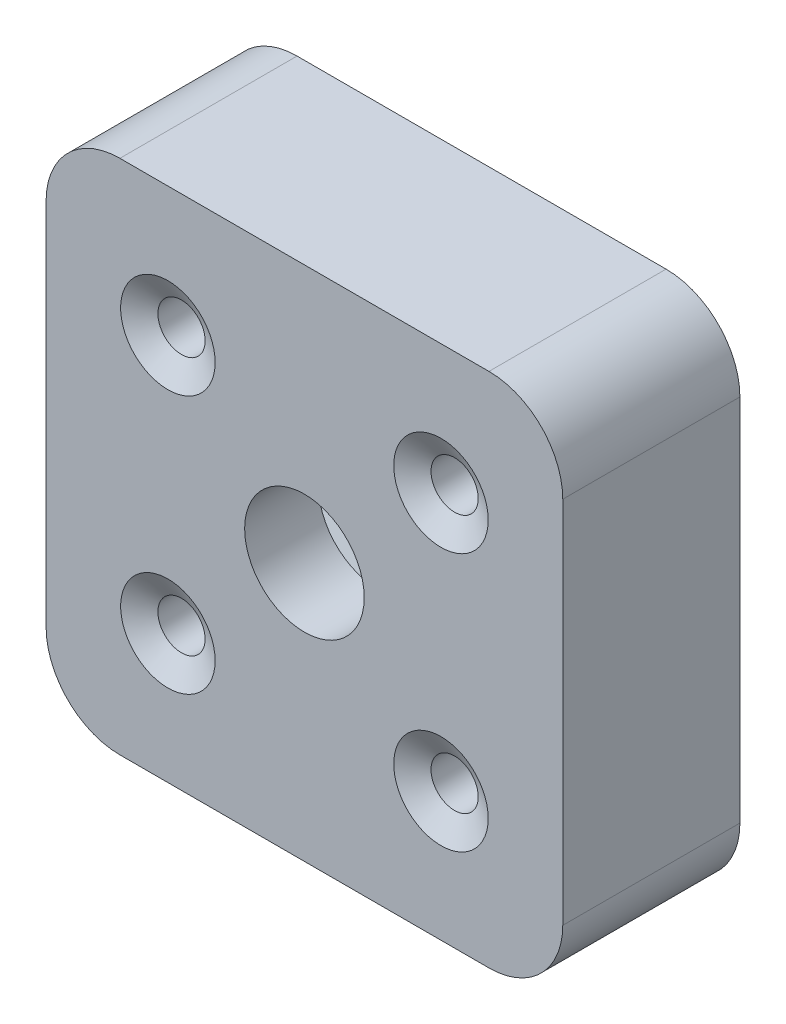
from build123d import *

# Parameters (mm, degrees)
SKETCH1_W                    = 35
SKETCH1_H                    = 35
SKETCH1_R                    = 4.05
SKETCH1_R_2                  = 1.6
BOSS_EXTRUDE1_DEPTH          = 12
FILLET1_R                    = 5
SKETCH5_R                    = 3.2
CUT_EXTRUDE1_DEPTH           = 1
CUT_EXTRUDE1_DRAFT           = -60
CUT_EXTRUDE1_PROFILE_2_DEPTH = 1
CUT_EXTRUDE1_PROFILE_2_DRAFT = -60
CUT_EXTRUDE1_PROFILE_3_DEPTH = 1
CUT_EXTRUDE1_PROFILE_3_DRAFT = -60
CUT_EXTRUDE1_PROFILE_4_DEPTH = 1
CUT_EXTRUDE1_PROFILE_4_DRAFT = -60
CUT_EXTRUDE2_DEPTH           = 7


with BuildPart() as part:
    # Sketch1 → Boss-Extrude1 (new body)
    with BuildSketch(Plane.XY):
        Rectangle(SKETCH1_W, SKETCH1_H)
        Circle(SKETCH1_R, mode=Mode.SUBTRACT)
        with Locations((-9.25, 8.75)):
            Circle(SKETCH1_R_2, mode=Mode.SUBTRACT)
        with Locations((9.25, 8.75)):
            Circle(SKETCH1_R_2, mode=Mode.SUBTRACT)
        with Locations((-9.25, -8.75)):
            Circle(SKETCH1_R_2, mode=Mode.SUBTRACT)
        with Locations((9.25, -8.75)):
            Circle(SKETCH1_R_2, mode=Mode.SUBTRACT)
    extrude(amount=BOSS_EXTRUDE1_DEPTH)

    # Fillet1
    fillet1_edges = [part.edges().sort_by_distance(p)[0] for p in [
        (-17.5, -17.5, 6),
        (-17.5, 17.5, 6),
        (17.5, 17.5, 6),
        (17.5, -17.5, 6),
    ]]
    fillet(fillet1_edges, radius=FILLET1_R)


with BuildPart() as cut_extrude1_tool:
    # Sketch5 → Cut-Extrude1 (with draft: the straight prism first)
    with BuildSketch(Plane.XY.offset(12)):
        with Locations((-9.25, 8.75)):
            Circle(SKETCH5_R)
    extrude(amount=-CUT_EXTRUDE1_DEPTH)
    # Cut-Extrude1: the draft: its side faces are tilted about the plane it starts from
    cut_extrude1_sides = [cut_extrude1_tool.faces().sort_by_distance(p)[0] for p in [
        (-12.45, 8.75, 11.5),
    ]]
    draft(cut_extrude1_sides, Plane.XY.offset(12), CUT_EXTRUDE1_DRAFT)


with BuildPart() as part_1:
    add(part.part)

    # Cut-Extrude1: cut by cut_extrude1_tool
    add(cut_extrude1_tool.part, mode=Mode.SUBTRACT)


with BuildPart() as cut_extrude1_profile_2_tool:
    # Sketch5 → Cut-Extrude1 profile 2 (with draft: the straight prism first)
    with BuildSketch(Plane.XY.offset(12)):
        with Locations((9.25, 8.75)):
            Circle(SKETCH5_R)
    extrude(amount=-CUT_EXTRUDE1_PROFILE_2_DEPTH)
    # Cut-Extrude1 profile 2: the draft: its side faces are tilted about the plane it starts from
    cut_extrude1_profile_2_sides = [cut_extrude1_profile_2_tool.faces().sort_by_distance(p)[0] for p in [
        (6.05, 8.75, 11.5),
    ]]
    draft(cut_extrude1_profile_2_sides, Plane.XY.offset(12), CUT_EXTRUDE1_PROFILE_2_DRAFT)


with BuildPart() as part_2:
    add(part_1.part)

    # Cut-Extrude1 profile 2: cut by cut_extrude1_profile_2_tool
    add(cut_extrude1_profile_2_tool.part, mode=Mode.SUBTRACT)


with BuildPart() as cut_extrude1_profile_3_tool:
    # Sketch5 → Cut-Extrude1 profile 3 (with draft: the straight prism first)
    with BuildSketch(Plane.XY.offset(12)):
        with Locations((-9.25, -8.75)):
            Circle(SKETCH5_R)
    extrude(amount=-CUT_EXTRUDE1_PROFILE_3_DEPTH)
    # Cut-Extrude1 profile 3: the draft: its side faces are tilted about the plane it starts from
    cut_extrude1_profile_3_sides = [cut_extrude1_profile_3_tool.faces().sort_by_distance(p)[0] for p in [
        (-12.45, -8.75, 11.5),
    ]]
    draft(cut_extrude1_profile_3_sides, Plane.XY.offset(12), CUT_EXTRUDE1_PROFILE_3_DRAFT)


with BuildPart() as part_3:
    add(part_2.part)

    # Cut-Extrude1 profile 3: cut by cut_extrude1_profile_3_tool
    add(cut_extrude1_profile_3_tool.part, mode=Mode.SUBTRACT)


with BuildPart() as cut_extrude1_profile_4_tool:
    # Sketch5 → Cut-Extrude1 profile 4 (with draft: the straight prism first)
    with BuildSketch(Plane.XY.offset(12)):
        with Locations((9.25, -8.75)):
            Circle(SKETCH5_R)
    extrude(amount=-CUT_EXTRUDE1_PROFILE_4_DEPTH)
    # Cut-Extrude1 profile 4: the draft: its side faces are tilted about the plane it starts from
    cut_extrude1_profile_4_sides = [cut_extrude1_profile_4_tool.faces().sort_by_distance(p)[0] for p in [
        (6.05, -8.75, 11.5),
    ]]
    draft(cut_extrude1_profile_4_sides, Plane.XY.offset(12), CUT_EXTRUDE1_PROFILE_4_DRAFT)


with BuildPart() as part_4:
    add(part_3.part)

    # Cut-Extrude1 profile 4: cut by cut_extrude1_profile_4_tool
    add(cut_extrude1_profile_4_tool.part, mode=Mode.SUBTRACT)

    # Sketch6 → Cut-Extrude2 (cut)
    with BuildSketch(Plane(origin=(0, 0, 0), x_dir=(-1, 0, 0), z_dir=(0, 0, -1))):
        Polygon((6.538491799, 3.775), (0, 7.55), (-6.538491799, 3.775), (-6.538491799, -3.775), (0, -7.55), (6.538491799, -3.775), align=None)
    extrude(amount=-CUT_EXTRUDE2_DEPTH, mode=Mode.SUBTRACT)


solid = part_4.part
